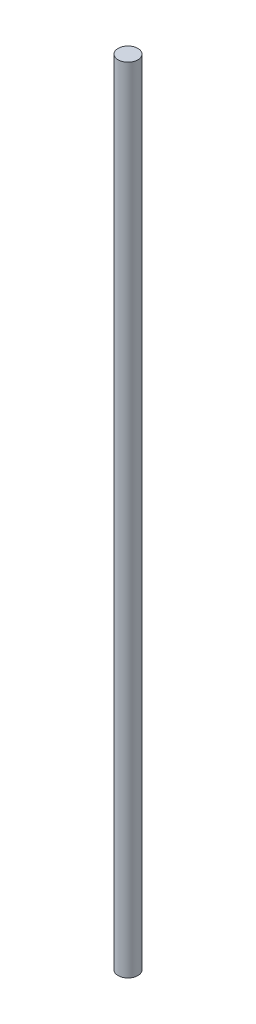
from build123d import *

# Parameters (mm, degrees)
SKETCH_1_R      = 5
EXTRUDE_1_DEPTH = 400


with BuildPart() as part:
    # Эскиз1 → Бобышка-Вытянуть1 (new body)
    with BuildSketch(Plane(origin=(0, 0, 0), x_dir=(1, 0, 0), z_dir=(0, 1, 0))):
        with Locations(Location((0, 0, 0), (0, 0, 270))):
            Circle(SKETCH_1_R)
    extrude(amount=EXTRUDE_1_DEPTH)


solid = part.part
